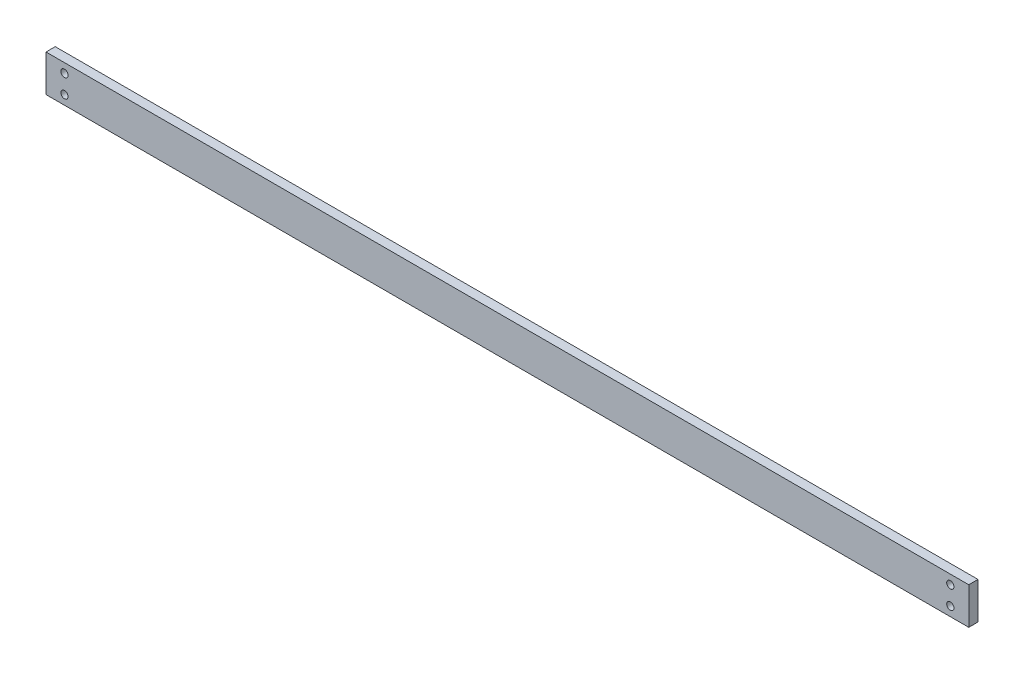
from build123d import *

# Parameters (mm, degrees)
SKETCH1_W               = 635
SKETCH1_H               = 25.4
BOSS_EXTRUDE1_DEPTH     = 3.175
CUT_EXTRUDE1_DEPTH      = 318.769760401
CUT_EXTRUDE1_DEPTH_BACK = 318.769760401
SKETCH2_R               = 2.4892


with BuildPart() as part:
    # Sketch1 → Boss-Extrude1 (new, symmetric)
    with BuildSketch(Plane.XY):
        Rectangle(SKETCH1_W, SKETCH1_H)
    extrude(amount=BOSS_EXTRUDE1_DEPTH, both=True)

    # Sketch2 → Cut-Extrude1 (cut, two sides: drawn at the far end of the back side and taken through both)
    with BuildSketch(Plane.XY.offset(-CUT_EXTRUDE1_DEPTH_BACK)):
        with Locations((304.8, -6.35)):
            Circle(SKETCH2_R)
        with Locations((304.8, 6.35)):
            Circle(SKETCH2_R)
        with Locations(Location((-304.8, 6.35, 0), (0, 0, 180))):
            Circle(SKETCH2_R)
        with Locations(Location((-304.8, -6.35, 0), (0, 0, 180))):
            Circle(SKETCH2_R)
    extrude(amount=CUT_EXTRUDE1_DEPTH + CUT_EXTRUDE1_DEPTH_BACK, mode=Mode.SUBTRACT)


solid = part.part
